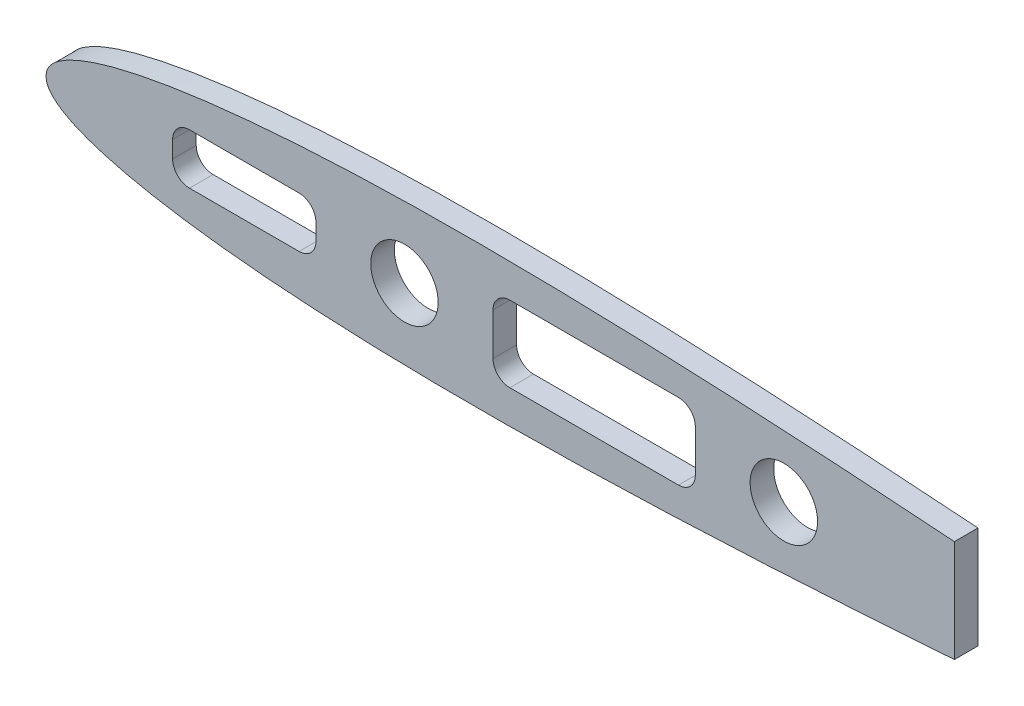
from build123d import *

# Parameters (mm, degrees)
SKETCH_1_R      = 4
EXTRUDE_1_DEPTH = 1.4


with BuildPart() as part:
    # Эскиз1 → Бобышка-Вытянуть1 (new, symmetric)
    with BuildSketch(Plane.XY):
        with BuildLine():
            Line((217.747634119, 2.35e-07), (217.747634119, 6.058113078))
            add(Edge.make_bspline(
                [(217.747634119, 6.058113078), (217.243808474, 6.094887376), (215.071311266, 6.252208631), (211.232977593, 6.52047435), (206.239642946, 6.848873), (201.268368917, 7.153826886), (196.331634567, 7.433105337), (191.441311474, 7.684604439), (186.608700127, 7.906218293), (181.844626933, 8.095958493), (177.159453511, 8.251957682), (172.563150272, 8.372486564), (168.065295924, 8.455953662), (163.675147454, 8.5010027), (159.401643404, 8.506522967), (155.253439756, 8.471528808), (151.238917925, 8.395506076), (147.366223919, 8.277985977), (143.643266298, 8.118975561), (140.077743555, 7.918678943), (136.677139412, 7.677604542), (133.448762895, 7.396480569), (130.399721686, 7.07642431), (127.536961089, 6.718650341), (124.867245825, 6.324666077), (122.397158974, 5.896120566), (120.133109351, 5.434797476), (118.081312133, 4.942567641), (116.247665798, 4.421392386), (114.63793972, 3.873060466), (113.256788366, 3.299309238), (112.109835923, 2.701306388), (111.196336341, 2.078555233), (110.530223642, 1.427069758), (110.085538218, 0.73423022), (110.027578176, 0.23672144), (110, 0)],
                knots=[0.362605011, 0.362605011, 0.362605011, 0.362605011, 0.371392651, 0.400495752, 0.429537687, 0.458441906, 0.487136113, 0.515551917, 0.543623846, 0.571289984, 0.59849081, 0.625169613, 0.651272029, 0.676746158, 0.701541791, 0.725611017, 0.748907835, 0.771387785, 0.793008139, 0.813728033, 0.833507815, 0.852309696, 0.87009731, 0.886835918, 0.902492782, 0.917037139, 0.930441054, 0.942679762, 0.953733567, 0.963589785, 0.972247019, 0.979722225, 0.986065145, 0.991385258, 0.995900989, 1, 1, 1, 1], degree=3))
            add(Edge.make_bspline(
                [(110, 0), (110.027578176, -0.23672144), (110.085538218, -0.73423022), (110.530223642, -1.427069758), (111.196336341, -2.078555233), (112.109835923, -2.701306388), (113.256788366, -3.299309238), (114.63793972, -3.873060466), (116.247665798, -4.421392386), (118.081312133, -4.942567641), (120.133109351, -5.434797476), (122.397158974, -5.896120566), (124.867245825, -6.324666077), (127.536961089, -6.718650341), (130.399721686, -7.07642431), (133.448762895, -7.396480569), (136.677139412, -7.677604542), (140.077743555, -7.918678943), (143.643266298, -8.118975561), (147.366223919, -8.277985977), (151.238917925, -8.395506076), (155.253439756, -8.471528808), (159.401643404, -8.506522967), (163.675147454, -8.5010027), (168.065295924, -8.455953662), (172.563150272, -8.372486564), (177.159453511, -8.251957682), (181.844626933, -8.095958493), (186.608700127, -7.906218293), (191.441311474, -7.684604439), (196.331634567, -7.433105337), (201.268368917, -7.153826886), (206.239642946, -6.848873), (211.232977593, -6.52047435), (215.071311266, -6.252208631), (217.243808474, -6.094887376), (217.747634119, -6.058113078)],
                knots=[0, 0, 0, 0, 0.004099011, 0.008614742, 0.013934855, 0.020277775, 0.027752981, 0.036410215, 0.046266433, 0.057320238, 0.069558946, 0.082962861, 0.097507218, 0.113164082, 0.12990269, 0.147690304, 0.166492185, 0.186271967, 0.206991861, 0.228612215, 0.251092165, 0.274388983, 0.298458209, 0.323253842, 0.348727971, 0.374830387, 0.40150919, 0.428710016, 0.456376154, 0.484448083, 0.512863887, 0.541558094, 0.570462313, 0.599504248, 0.628607349, 0.637394989, 0.637394989, 0.637394989, 0.637394989], degree=3))
            Line((217.747634119, -6.058113078), (217.747634119, 2.35e-07))
        make_face()
        with BuildLine():
            Line((140.01848428, -3), (127.01848428, -3))
            ThreePointArc((127.01848428, -3), (125.604270718, -2.414213562), (125.01848428, -1))
            Line((125.01848428, -1), (125.01848428, 1))
            ThreePointArc((125.01848428, 1), (125.604270718, 2.414213562), (127.01848428, 3))
            Line((127.01848428, 3), (140.01848428, 3))
            ThreePointArc((140.01848428, 3), (141.432697843, 2.414213562), (142.01848428, 1))
            Line((142.01848428, 1), (142.01848428, -1))
            ThreePointArc((142.01848428, -1), (141.432697843, -2.414213562), (140.01848428, -3))
        make_face(mode=Mode.SUBTRACT)
        with Locations((152.51848428, 0)):
            Circle(SKETCH_1_R, mode=Mode.SUBTRACT)
        with BuildLine():
            Line((185.01848428, -4.5), (165.01848428, -4.5))
            ThreePointArc((165.01848428, -4.5), (163.604270718, -3.914213562), (163.01848428, -2.5))
            Line((163.01848428, -2.5), (163.01848428, 2.5))
            ThreePointArc((163.01848428, 2.5), (163.604270718, 3.914213562), (165.01848428, 4.5))
            Line((165.01848428, 4.5), (185.01848428, 4.5))
            ThreePointArc((185.01848428, 4.5), (186.432697843, 3.914213562), (187.01848428, 2.5))
            Line((187.01848428, 2.5), (187.01848428, -2.5))
            ThreePointArc((187.01848428, -2.5), (186.432697843, -3.914213562), (185.01848428, -4.5))
        make_face(mode=Mode.SUBTRACT)
        with Locations((197.51848428, 0)):
            Circle(SKETCH_1_R, mode=Mode.SUBTRACT)
    extrude(amount=EXTRUDE_1_DEPTH, both=True)


solid = part.part
